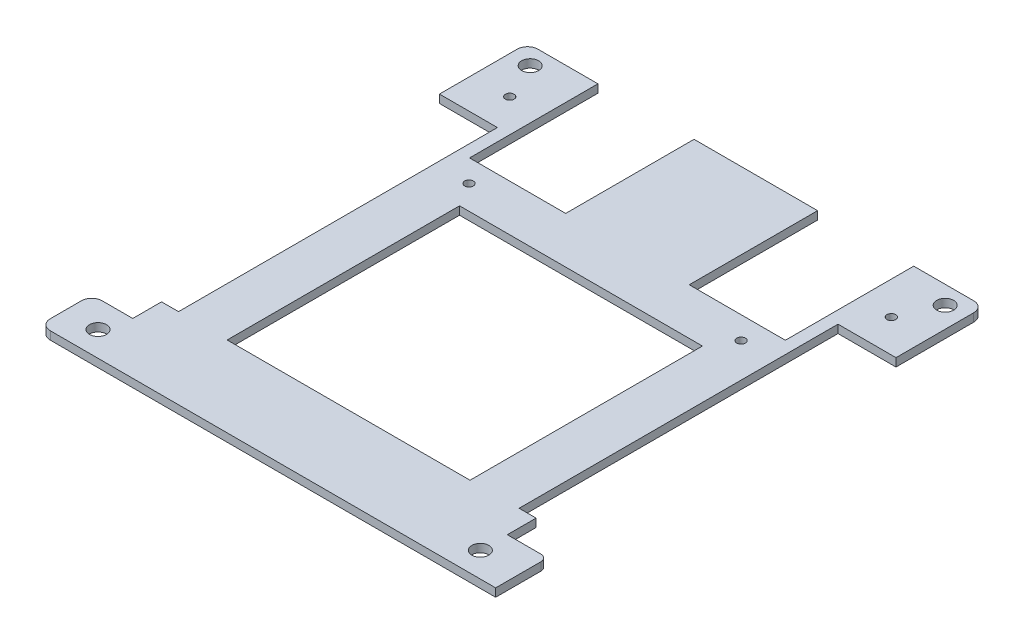
from build123d import *

# Parameters (mm, degrees)
SKETCH1_R           = 1.6383
SKETCH1_R_2         = 0.8382
BOSS_EXTRUDE1_DEPTH = 1.575
CUT_EXTRUDE1_DEPTH  = 2.54
SKETCH15_R          = 0.8382
CUT_EXTRUDE5_DEPTH  = 1.575
BOSS_EXTRUDE2_DEPTH = 1.575


with BuildPart() as part:
    # Sketch1 → Boss-Extrude1 (new body)
    with BuildSketch(Plane(origin=(0, 0, 0), x_dir=(1, 0, 0), z_dir=(0, 1, 0))):
        with BuildLine():
            Line((-44, 45), (-44, 30.014))
            Line((-44, 30.014), (-32.824, 30.014))
            Line((-32.824, 30.014), (-32.824, -31.454))
            Line((-32.824, -31.454), (-36.100000052, -31.454))
            Line((-36.100000052, -31.454), (-36.100000052, -37))
            Line((-36.100000052, -37), (-41.999999948, -37))
            ThreePointArc((-41.999999948, -37), (-43.409459738, -37.574276641), (-43.999999948, -38.977))
            Line((-43.999999948, -38.977), (-43.999999948, -45))
            ThreePointArc((-43.999999948, -45), (-43.41421351, -46.414213562), (-41.999999948, -47))
            Line((-41.999999948, -47), (42.705916546, -47))
            Line((42.705916546, -47), (43.849731117, -47))
            Line((43.849731117, -47), (43.849731117, -38.27))
            ThreePointArc((43.849731117, -38.27), (43.47775673, -37.371974388), (42.579731117, -37))
            Line((42.579731117, -37), (36.100000052, -37))
            Line((36.100000052, -37), (36.100000052, -31.454))
            Line((36.100000052, -31.454), (32.824, -31.454))
            Line((32.824, -31.454), (32.824, 30.014))
            Line((32.824, 30.014), (44, 30.014))
            Line((44, 30.014), (44, 31.284))
            Line((44, 31.284), (44, 45))
            ThreePointArc((44, 45), (43.414213562, 46.414213562), (42, 47))
            Line((42, 47), (-42, 47))
            ThreePointArc((-42, 47), (-43.414213562, 46.414213562), (-44, 45))
        make_face()
        with Locations(Location((40, 43.5, 0), (0, 0, 270))):
            Circle(SKETCH1_R, mode=Mode.SUBTRACT)
        with Locations(Location((-40, 43.5, 0), (0, 0, 270))):
            Circle(SKETCH1_R, mode=Mode.SUBTRACT)
        with Locations(Location((-37.599999948, -42.2, 0), (0, 0, 270))):
            Circle(SKETCH1_R, mode=Mode.SUBTRACT)
        with Locations(Location((36.100000052, -42.2, 0), (0, 0, 270))):
            Circle(SKETCH1_R, mode=Mode.SUBTRACT)
        with Locations(Location((26.22, 17.931928709, 0), (0, 0, 270))):
            Circle(SKETCH1_R_2, mode=Mode.SUBTRACT)
        with Locations(Location((-26.22, 17.931928709, 0), (0, 0, 270))):
            Circle(SKETCH1_R_2, mode=Mode.SUBTRACT)
        Polygon((23.409, -31.5), (-23.409, -31.5), (-23.409, 13.29544), (-12.909, 13.29544), (-12.909, 25.99544), (12.909, 25.99544), (12.909, 13.29544), (23.409, 13.29544), align=None, mode=Mode.SUBTRACT)
    extrude(amount=BOSS_EXTRUDE1_DEPTH)

    # Sketch2 → Cut-Extrude1 (cut)
    with BuildSketch(Plane(origin=(0, 1.575, 0), x_dir=(1, 0, 0), z_dir=(0, 1, 0))):
        Polygon((-12.909, 19.06), (-30.435, 19.06), (-30.435, 47), (30.435, 47), (30.435, 19.06), (12.909, 19.06), (12.909, 25.99544), (-12.909, 25.99544), align=None)
    extrude(amount=-CUT_EXTRUDE1_DEPTH, mode=Mode.SUBTRACT)

    # Sketch15 → Cut-Extrude5 (cut)
    with BuildSketch(Plane(origin=(0, 1.575, 0), x_dir=(1, 0, 0), z_dir=(0, 1, 0))):
        with Locations(Location((-36.785, 36.35, 0), (0, 0, 270))):
            Circle(SKETCH15_R)
        with Locations(Location((36.785, 36.332, 0), (0, 0, 270))):
            Circle(SKETCH15_R)
    extrude(amount=-CUT_EXTRUDE5_DEPTH, mode=Mode.SUBTRACT)

    # Sketch16 → Boss-Extrude2 (add)
    with BuildSketch(Plane(origin=(0, 1.575, 0), x_dir=(1, 0, 0), z_dir=(0, 1, 0))):
        Polygon((12.909, 19.06), (12.909, 13.29544), (-12.909, 13.29544), (-12.909, 19.06), (-30.435, 19.06), (-30.435, 22.25535429), (-11.909, 22.25535429), (-11.909, 47), (11.909, 47), (11.909, 22.25535429), (30.435, 22.25535429), (30.435, 19.06), align=None)
    extrude(amount=-BOSS_EXTRUDE2_DEPTH)


solid = part.part
